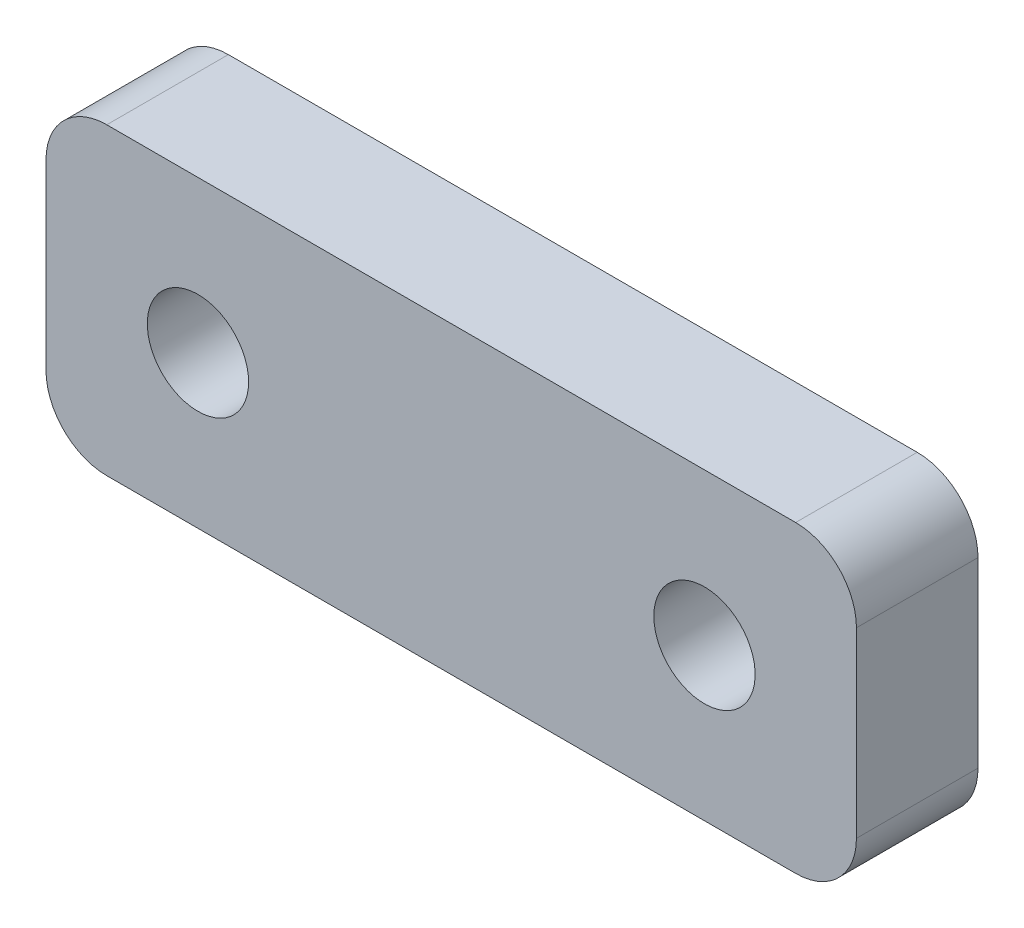
from build123d import *

# Parameters (mm, degrees)
SKETCH_1_W          = 40
SKETCH_1_H          = 15
EXTRUDE_1_DEPTH     = 6
SKETCH_2_R          = 2.5
CUT_EXTRUDE_1_DEPTH = 23.186707732
FILLET_1_R          = 3


with BuildPart() as part:
    # 草图1 → 凸台-拉伸1 (new body)
    with BuildSketch(Plane.XY):
        Rectangle(SKETCH_1_W, SKETCH_1_H)
    extrude(amount=EXTRUDE_1_DEPTH)

    # 草图2 → 切除-拉伸1 (cut, through all)
    with BuildSketch(Plane.XY.offset(6)):
        with Locations((-12.5, 0)):
            Circle(SKETCH_2_R)
        with Locations(Location((12.5, 0, 0), (0, 0, 180))):
            Circle(SKETCH_2_R)
    extrude(amount=-CUT_EXTRUDE_1_DEPTH, mode=Mode.SUBTRACT)

    # 圆角1
    fillet_1_edges = [part.edges().sort_by_distance(p)[0] for p in [
        (20, -7.5, 3),
        (-20, -7.5, 3),
        (-20, 7.5, 3),
        (20, 7.5, 3),
    ]]
    fillet(fillet_1_edges, radius=FILLET_1_R)


solid = part.part
